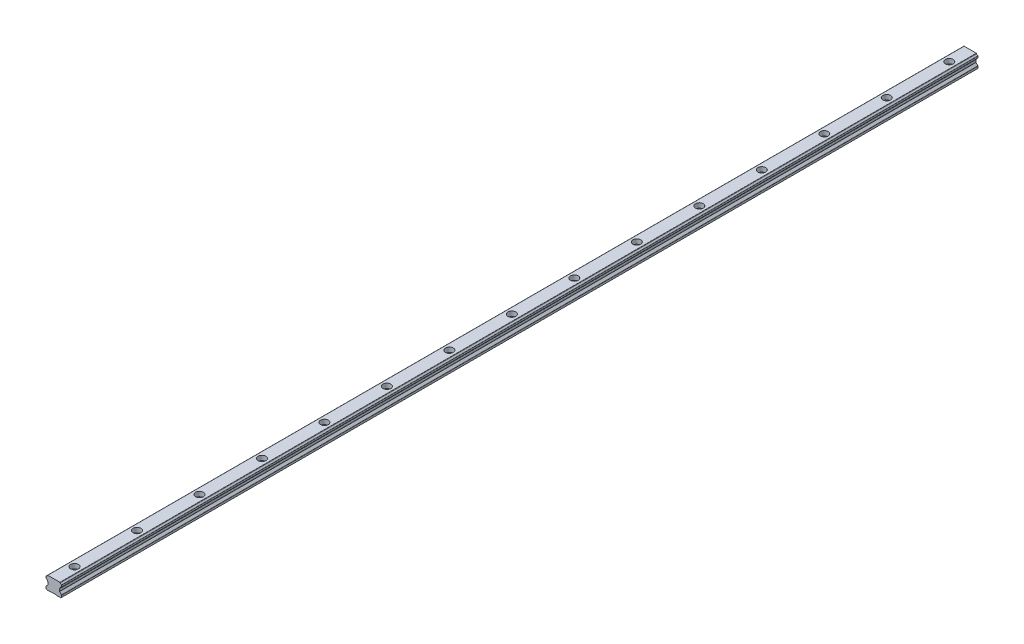
from build123d import *

# Parameters (mm, degrees)
EXTRUDE_1_DEPTH        = 880
CUT_EXTRUDE_2_REACH    = 1492.384
SKETCH_2_R             = 2.25
SKETCH_4_R             = 3.75
CUT_EXTRUDE_10_DEPTH   = 4.5
PATTERN_LINEAR_1_COUNT = 15
PATTERN_LINEAR_1_PITCH = 60


with BuildPart() as part:
    # 草图1 → 拉伸1 (new body)
    with BuildSketch(Plane.XY):
        with BuildLine():
            Line((1192.933741322, 427.89461201), (1188.483761052, 427.89461201))
            Line((1188.483761052, 427.89461201), (1187.783750122, 428.594622917))
            Line((1187.783750122, 428.594622917), (1187.783750122, 430.38767109))
            ThreePointArc((1187.783750122, 430.38767109), (1187.821842198, 430.578923241), (1187.930196731, 430.74105802))
            Line((1187.930196731, 430.74105802), (1189.695882156, 432.506743445))
            ThreePointArc((1189.695882156, 432.506743445), (1189.760913981, 432.604070449), (1189.783750122, 432.718875479))
            Line((1189.783750122, 432.718875479), (1189.783750122, 434.876567432))
            ThreePointArc((1189.783750122, 434.876567432), (1189.760914094, 434.991372191), (1189.695882571, 435.088699051))
            Line((1189.695882571, 435.088699051), (1189.264595994, 435.519987316))
            ThreePointArc((1189.264595994, 435.519987316), (1189.205417093, 435.60409491), (1189.178120982, 435.703247076))
            ThreePointArc((1189.178120982, 435.703247076), (1188.812766668, 436.527663733), (1188.026699583, 436.969529251))
            ThreePointArc((1188.026699583, 436.969529251), (1187.852325013, 437.073155717), (1187.783750122, 437.264054693))
            Line((1187.783750122, 437.264054693), (1187.783750122, 438.725335317))
            ThreePointArc((1187.783750122, 438.725335317), (1187.852375251, 438.916137249), (1188.026699559, 439.01970279))
            ThreePointArc((1188.026699559, 439.01970279), (1188.765921394, 439.412444701), (1189.158663305, 440.151666536))
            ThreePointArc((1189.158663305, 440.151666536), (1189.26228977, 440.326041106), (1189.453188747, 440.394615998))
            Line((1189.453188747, 440.394615998), (1201.114311381, 440.394615998))
            ThreePointArc((1201.114311381, 440.394615998), (1201.305210357, 440.326041106), (1201.408836823, 440.151666536))
            ThreePointArc((1201.408836823, 440.151666536), (1201.801578733, 439.4124447), (1202.540800569, 439.01970279))
            ThreePointArc((1202.540800569, 439.01970279), (1202.715175139, 438.916076324), (1202.783750031, 438.725177348))
            Line((1202.783750031, 438.725177348), (1202.783750031, 437.263896724))
            ThreePointArc((1202.783750031, 437.263896724), (1202.71512489, 437.073094794), (1202.540800569, 436.969529272))
            ThreePointArc((1202.540800569, 436.969529272), (1201.754733531, 436.527663779), (1201.389379239, 435.703247172))
            ThreePointArc((1201.389379239, 435.703247172), (1201.362083129, 435.604095006), (1201.302904227, 435.519987412))
            Line((1201.302904227, 435.519987412), (1200.87161765, 435.088699147))
            ThreePointArc((1200.87161765, 435.088699147), (1200.806586127, 434.991372287), (1200.783750099, 434.876567528))
            Line((1200.783750099, 434.876567528), (1200.783750099, 432.718875575))
            ThreePointArc((1200.783750099, 432.718875575), (1200.80658624, 432.604070545), (1200.871618065, 432.506743541))
            Line((1200.871618065, 432.506743541), (1202.63730349, 430.741058116))
            ThreePointArc((1202.63730349, 430.741058116), (1202.745689896, 430.578846399), (1202.783750122, 430.387504629))
            Line((1202.783750122, 430.387504629), (1202.783750122, 428.594622917))
            Line((1202.783750122, 428.594622917), (1202.083739191, 427.89461201))
            Line((1202.083739191, 427.89461201), (1197.633758921, 427.89461201))
            Line((1197.633758921, 427.89461201), (1197.333760112, 428.19461125))
            Line((1197.333760112, 428.19461125), (1193.233740132, 428.19461125))
            Line((1193.233740132, 428.19461125), (1192.933741322, 427.89461201))
        make_face()
    extrude(amount=EXTRUDE_1_DEPTH)

    # 草图2 → 拉伸2 (cut, up to next)
    with BuildSketch(Plane(origin=(0, 440.394615998, 0), x_dir=(1, 0, 0), z_dir=(0, 1, 0)), mode=Mode.PRIVATE) as cut_extrude_2_sk1:
        with Locations(Location((1195.164876507, -860, 0), (0, 0, 270))):
            Circle(SKETCH_2_R)
    cut_extrude_2_tool1 = extrude(cut_extrude_2_sk1.sketch, amount=-CUT_EXTRUDE_2_REACH, mode=Mode.PRIVATE) & part.part
    cut_extrude_2 = cut_extrude_2_tool1.solids().sort_by_distance((1195.164877, 440.394616, 860))[0]
    add(cut_extrude_2, mode=Mode.SUBTRACT)

    # 草图4 → 拉伸10 (cut)
    with BuildSketch(Plane(origin=(0, 440.394615998, 0), x_dir=(1, 0, 0), z_dir=(0, 1, 0))):
        with Locations(Location((1195.164876507, -860, 0), (0, 0, 270))):
            Circle(SKETCH_4_R)
    cut_extrude_10 = extrude(amount=-CUT_EXTRUDE_10_DEPTH, mode=Mode.SUBTRACT)

    # 阵列(线性)1: 拉伸2, 拉伸10 ×15
    with Locations(*[(0, 0, -i * PATTERN_LINEAR_1_PITCH) for i in range(1, PATTERN_LINEAR_1_COUNT)]):
        add(cut_extrude_2, mode=Mode.SUBTRACT)
        add(cut_extrude_10, mode=Mode.SUBTRACT)


solid = part.part
